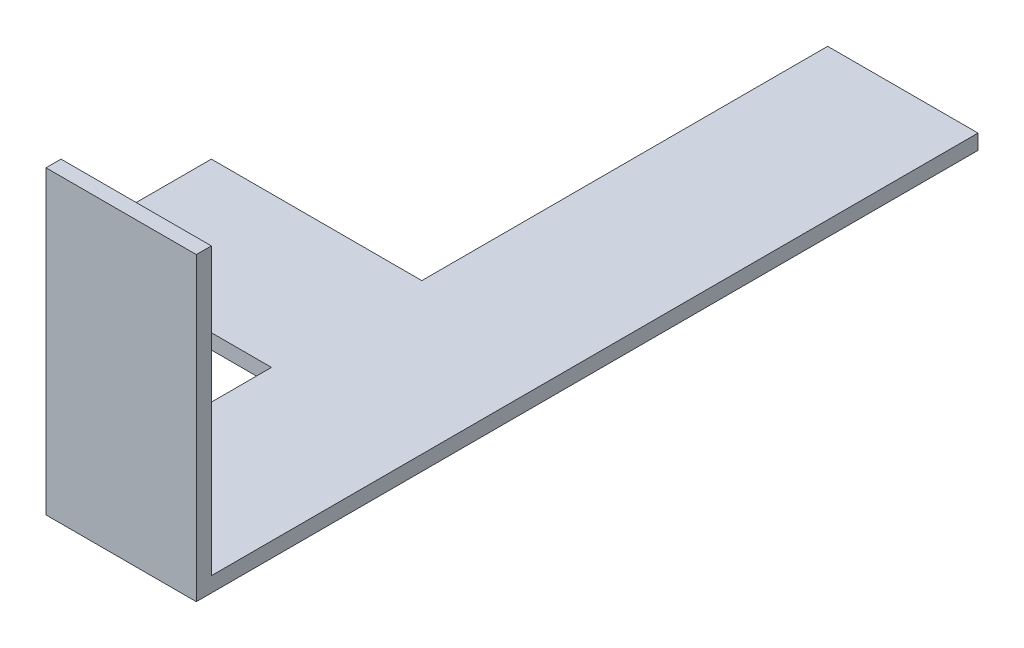
from build123d import *

# Parameters (mm, degrees)
SKETCH1_W           = 10
SKETCH1_H           = 25
SKETCH1_H_2         = 27
SKETCH1_W_2         = 14
SKETCH1_H_3         = 10
BOSS_EXTRUDE1_DEPTH = 1
SKETCH2_W           = 10
SKETCH2_H           = 1
BOSS_EXTRUDE2_DEPTH = 20


with BuildPart() as part:
    # Sketch1 → Boss-Extrude1 (new body)
    with BuildSketch(Plane(origin=(0, 0, 0), x_dir=(1, 0, 0), z_dir=(0, 1, 0))):
        with Locations((5, -39.5)):
            Rectangle(SKETCH1_W, SKETCH1_H)
        with Locations((5, -13.5)):
            Rectangle(SKETCH1_W, SKETCH1_H_2)
        with Locations((-7, -32)):
            Rectangle(SKETCH1_W_2, SKETCH1_H_3)
    extrude(amount=BOSS_EXTRUDE1_DEPTH)

    # Sketch2 → Boss-Extrude2 (add)
    with BuildSketch(Plane.XZ):
        with Locations((5, 51.5)):
            Rectangle(SKETCH2_W, SKETCH2_H)
    extrude(amount=-BOSS_EXTRUDE2_DEPTH)


solid = part.part
